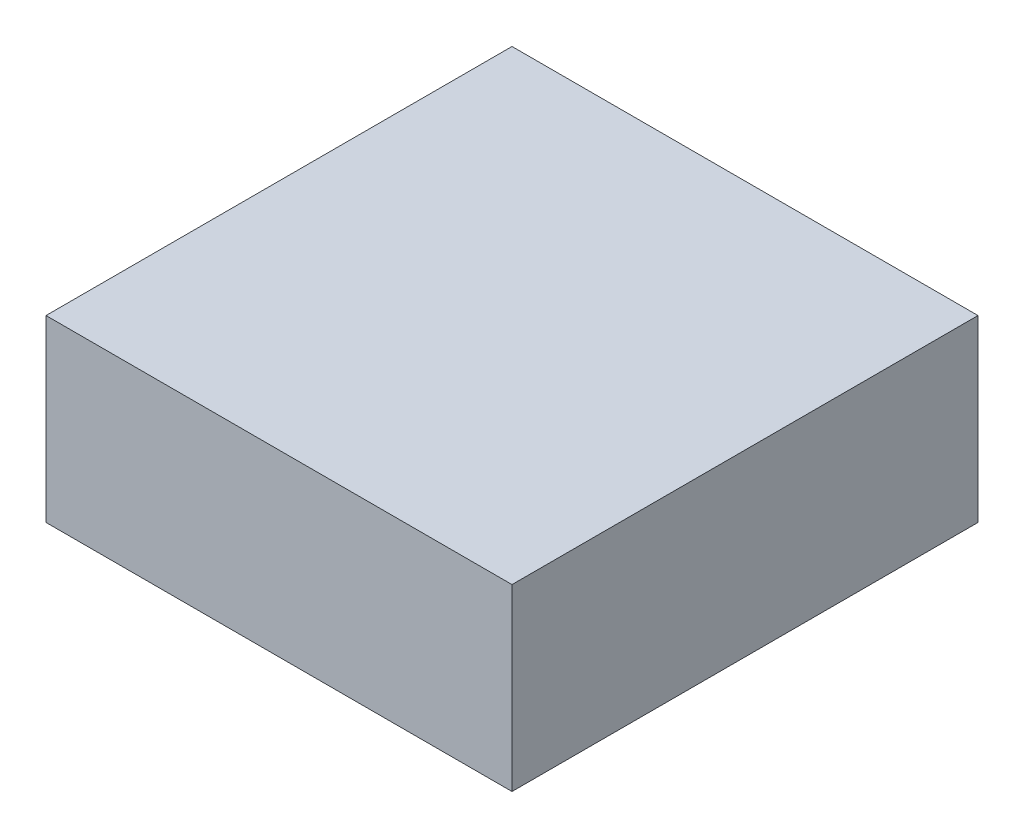
from build123d import *

# Parameters (mm, degrees)
SKETCH1_W           = 13
SKETCH1_H           = 13
BOSS_EXTRUDE1_DEPTH = 5


with BuildPart() as part:
    # Sketch1 → Boss-Extrude1 (new body)
    with BuildSketch(Plane(origin=(0, 0, 0), x_dir=(1, 0, 0), z_dir=(0, 1, 0))):
        with Locations((0.310933941, -0.740318907)):
            Rectangle(SKETCH1_W, SKETCH1_H)
    extrude(amount=BOSS_EXTRUDE1_DEPTH)


solid = part.part
